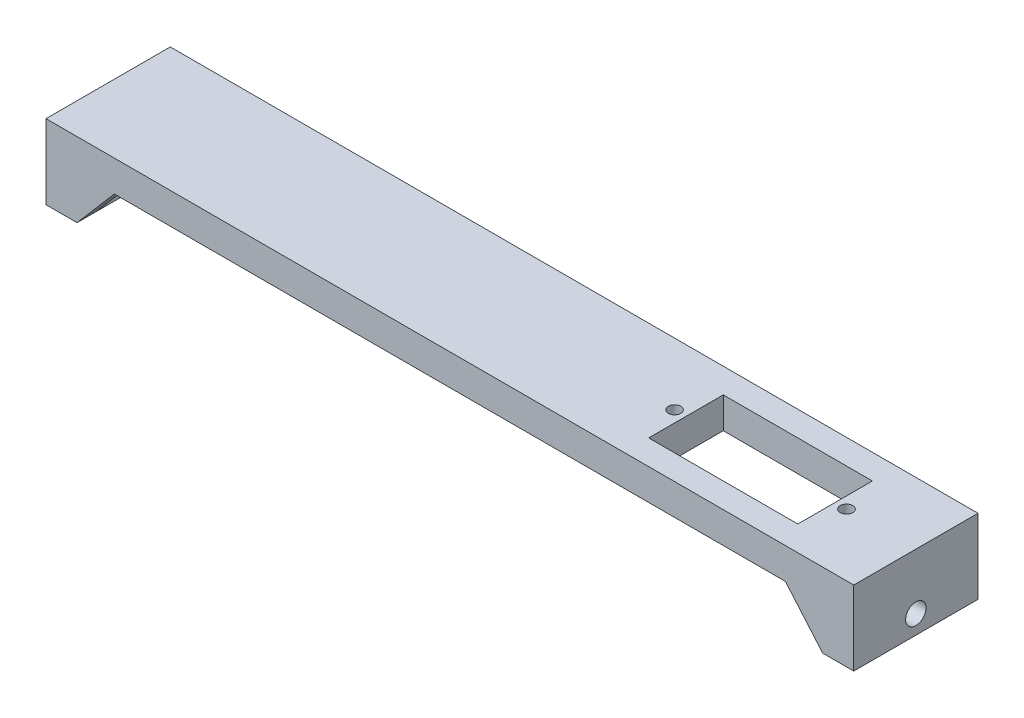
from build123d import *

# Parameters (mm, degrees)
EXTRUDE_2_DEPTH          = 20
CUT_EXTRUDE_1_DEPTH      = 128.157382798
CUT_EXTRUDE_1_DEPTH_BACK = 128.157382798
SKETCH_3_R               = 1.65
EXTRUDE_3_DEPTH          = 3
MIRROR_2_COPY_1_DEPTH    = 3
SKETCH_7_W               = 24
SKETCH_7_H               = 12
CUT_EXTRUDE_2_DEPTH      = 5
SKETCH_10_R              = 1
CUT_EXTRUDE_3_DEPTH      = 5


with BuildPart() as part:
    # 草图1 → 凸台-拉伸2 (new body)
    with BuildSketch(Plane.XY):
        Polygon((-65, 0), (65, 0), (65, -12), (60, -12), (60, -5), (-60, -5), (-60, -12), (-65, -12), align=None)
    extrude(amount=EXTRUDE_2_DEPTH)

    # 草图3 → 切除-拉伸1 (cut, two sides: drawn at the far end of the back side and taken through both)
    with BuildSketch(Plane(origin=(-60, 0, 0), x_dir=(0, 0, -1), z_dir=(1, 0, 0)).offset(-CUT_EXTRUDE_1_DEPTH_BACK)):
        with Locations(Location((-10, -9, 0), (0, 0, 90))):
            Circle(SKETCH_3_R)
    extrude(amount=CUT_EXTRUDE_1_DEPTH + CUT_EXTRUDE_1_DEPTH_BACK, mode=Mode.SUBTRACT)

    # 草图4 → 凸台-拉伸3 (add)
    with BuildSketch(Plane(origin=(0, 0, 0), x_dir=(-1, 0, 0), z_dir=(0, 0, -1))):
        Polygon((54, -5), (60, -12), (60, -5), align=None)
    extrude_3 = extrude(amount=-EXTRUDE_3_DEPTH)

    # 镜向1: 凸台-拉伸3 across plane
    add(extrude_3.mirror(Plane.XY.offset(10)))

    # 镜向2: 凸台-拉伸3 across plane
    add(extrude_3.mirror(Plane(origin=(0, 0, 0), x_dir=(0, 0, 1), z_dir=(1, 0, 0))))

    # 镜向2 copy 1 sketch → 镜向2 copy 1 (add)
    with BuildSketch(Plane.XY.offset(20)):
        Polygon((54, -5), (60, -12), (60, -5), align=None)
    extrude(amount=-MIRROR_2_COPY_1_DEPTH)

    # 草图7 → 切除-拉伸2 (cut)
    with BuildSketch(Plane.XZ.offset(5)):
        with Locations((40, 10)):
            Rectangle(SKETCH_7_W, SKETCH_7_H)
    extrude(amount=-CUT_EXTRUDE_2_DEPTH, mode=Mode.SUBTRACT)

    # 草图10 → 切除-拉伸3 (cut)
    with BuildSketch(Plane.XZ.offset(5)):
        with Locations(Location((53.835, 10, 0), (0, 0, 270))):
            Circle(SKETCH_10_R)
        with Locations(Location((26.165, 10, 0), (0, 0, 270))):
            Circle(SKETCH_10_R)
    extrude(amount=-CUT_EXTRUDE_3_DEPTH, mode=Mode.SUBTRACT)


solid = part.part
